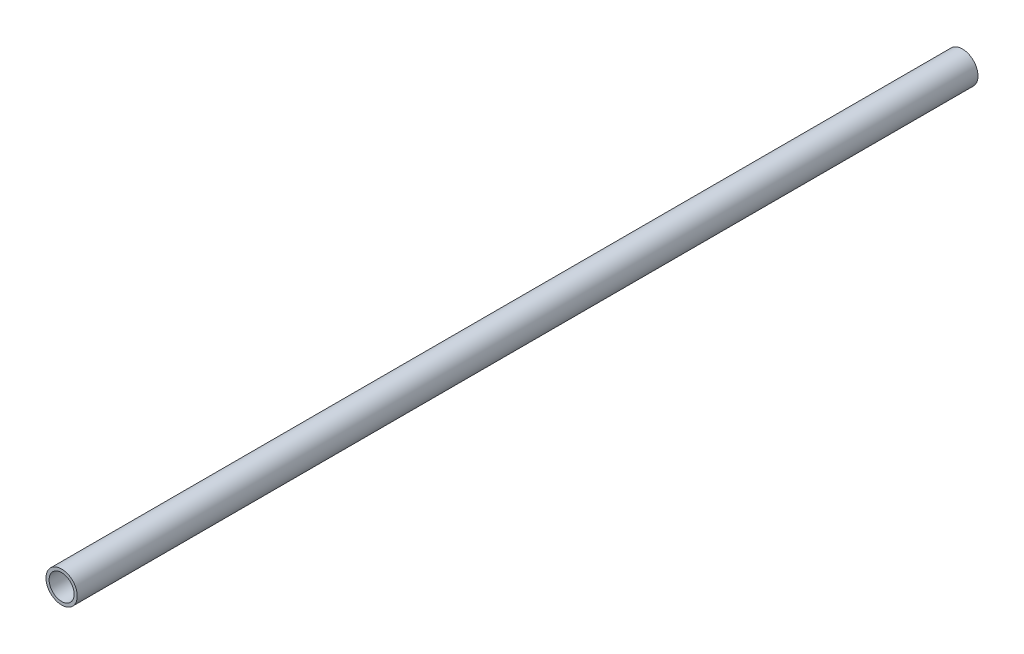
from build123d import *

# Parameters (mm, degrees)
SKETCH3_R           = 15.875
SKETCH3_R_2         = 12.7
BOSS_EXTRUDE1_DEPTH = 457.2


with BuildPart() as part:
    # Sketch3 → Boss-Extrude1 (new, symmetric)
    with BuildSketch(Plane.XY):
        Circle(SKETCH3_R)
        Circle(SKETCH3_R_2, mode=Mode.SUBTRACT)
    extrude(amount=BOSS_EXTRUDE1_DEPTH, both=True)


solid = part.part
